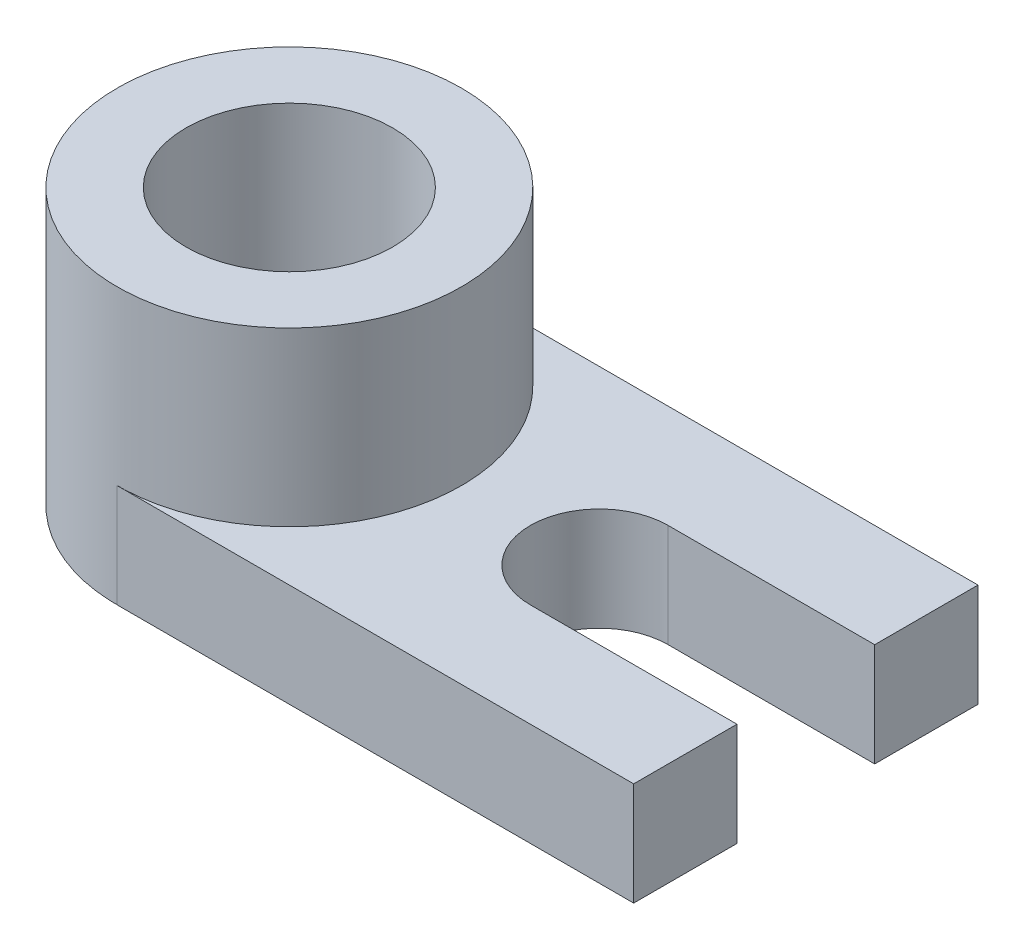
from build123d import *

# Parameters (mm, degrees)
SKETCH1_W               = 75
SKETCH1_H               = 50
BOSS_EXTRUDE1_DEPTH     = 15
SKETCH2_R               = 25
BOSS_EXTRUDE2_DEPTH     = 40
SKETCH3_R               = 15
CUT_EXTRUDE1_DEPTH      = 99.615414617
SKETCH5_W               = 10
SKETCH5_H               = 15
CUT_EXTRUDE2_REACH      = 120.743
CUT_EXTRUDE2_END_RADIUS = 10
SKETCH7_W               = 20
SKETCH7_H               = 15


with BuildPart() as part:
    # Sketch1 → Boss-Extrude1 (new body)
    with BuildSketch(Plane(origin=(0, 0, 0), x_dir=(1, 0, 0), z_dir=(0, 1, 0))):
        with Locations((37.5, 25)):
            Rectangle(SKETCH1_W, SKETCH1_H)
    extrude(amount=BOSS_EXTRUDE1_DEPTH)


with BuildPart() as body_2:
    # Sketch2 → Boss-Extrude2 (new body)
    with BuildSketch(Plane.XZ):
        with Locations(Location((0, -25, 0), (0, 0, 270))):
            Circle(SKETCH2_R)
    extrude(amount=-BOSS_EXTRUDE2_DEPTH)


with BuildPart() as cut_extrude1_tool:
    # Sketch3 → Cut-Extrude1 (new, through all)
    with BuildSketch(Plane(origin=(0, 40, 0), x_dir=(1, 0, 0), z_dir=(0, 1, 0))):
        with Locations(Location((0, 25, 0), (0, 0, 270))):
            Circle(SKETCH3_R)
    extrude(amount=-CUT_EXTRUDE1_DEPTH)


with BuildPart() as part_1:
    add(part.part)

    # Cut-Extrude1: cut by cut_extrude1_tool
    add(cut_extrude1_tool.part, mode=Mode.SUBTRACT)

    # Sketch5 → Ø20.0 (20) Diameter Hole1 (revolve, cut)
    with BuildSketch(Plane(origin=(45, 15, -25), x_dir=(0, 0, 1), z_dir=(1, 0, 0))):
        with Locations((5, 7.5)):
            Rectangle(SKETCH5_W, SKETCH5_H)
    revolve(axis=Axis((45, 21.35, -25), (0, -1, 0)), mode=Mode.SUBTRACT)

    # Cut-Extrude2: up to this cylinder (the profile starts outside it)
    cut_extrude2_end = Plane(origin=(45, 7.5, -25), z_dir=(0, 1, 0)) * Cylinder(CUT_EXTRUDE2_END_RADIUS, 262.486, mode=Mode.PRIVATE)
    # Sketch7 → Cut-Extrude2 (cut, up to the surface)
    with BuildSketch(Plane(origin=(75, 0, 0), x_dir=(0, 0, -1), z_dir=(1, 0, 0)), mode=Mode.PRIVATE) as cut_extrude2_sk1:
        with Locations((25, 7.5)):
            Rectangle(SKETCH7_W, SKETCH7_H)
    cut_extrude2_tool1 = extrude(cut_extrude2_sk1.sketch, amount=-CUT_EXTRUDE2_REACH, mode=Mode.PRIVATE) - cut_extrude2_end
    add(cut_extrude2_tool1.solids().sort_by_distance((75, 7.5, -25))[0], mode=Mode.SUBTRACT)


with BuildPart() as body_2_1:
    add(body_2.part)

    # Cut-Extrude1: cut by cut_extrude1_tool
    add(cut_extrude1_tool.part, mode=Mode.SUBTRACT)


solid = Compound([part_1.part, body_2_1.part])
